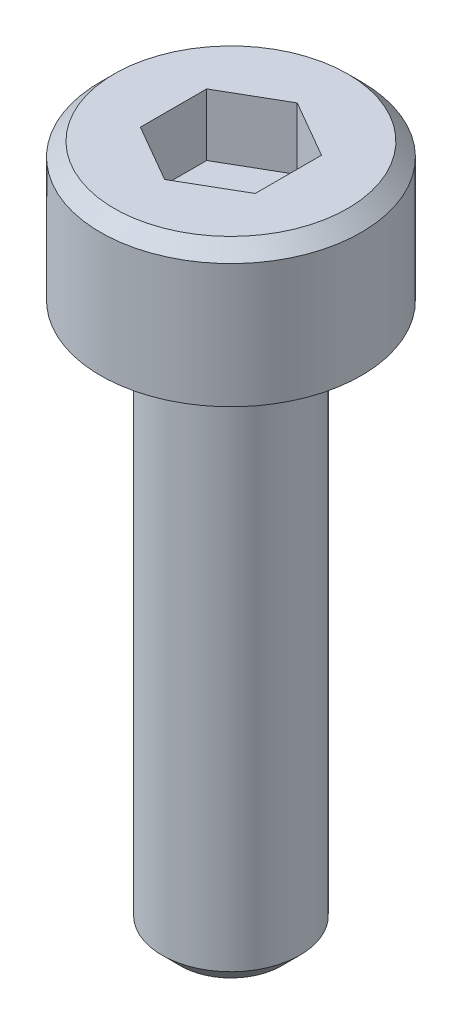
from build123d import *

# Parameters (mm, degrees)
CUT_EXTRUDE1_DEPTH = 1.35


with BuildPart() as part:
    # Sketch1 → Revolve1 (revolve)
    with BuildSketch(Plane.XY, mode=Mode.PRIVATE) as revolve1_sk:
        Polygon((0, -12), (1.1, -12), (1.5, -11.6), (1.5, 0), (2.84, 0), (2.84, 2.7), (2.54, 3), (0, 3), align=None)
    revolve(revolve1_sk.sketch.rotate(Axis((0, -10, 0), (0, 1, 0)), 90), axis=Axis((0, -10, 0), (0, 1, 0)))

    # Sketch2 → Cut-Extrude1 (cut)
    with BuildSketch(Plane(origin=(0, 3, 0), x_dir=(1, 0, 0), z_dir=(0, 1, 0))):
        Polygon((1.25, -0.721687836), (0, -1.443375673), (-1.25, -0.721687836), (-1.25, 0.721687836), (0, 1.443375673), (1.25, 0.721687836), align=None)
    extrude(amount=-CUT_EXTRUDE1_DEPTH, mode=Mode.SUBTRACT)


solid = part.part
